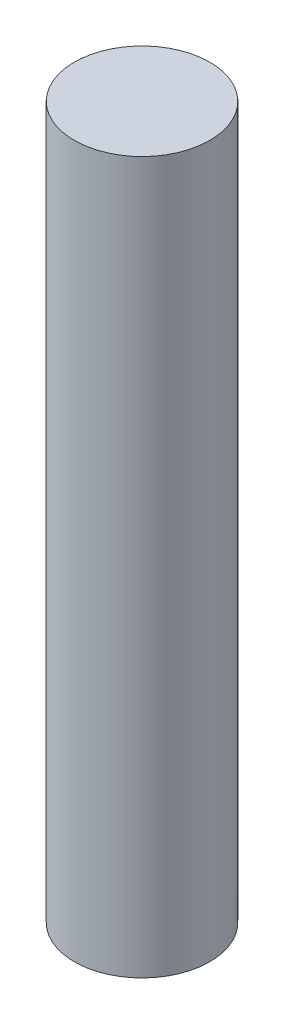
from build123d import *

# Parameters (mm, degrees)
SKETCH1_R           = 2
BOSS_EXTRUDE1_DEPTH = 21


with BuildPart() as part:
    # Sketch1 → Boss-Extrude1 (new body)
    with BuildSketch(Plane(origin=(0, 0, 0), x_dir=(1, 0, 0), z_dir=(0, 1, 0))):
        with Locations(Location((0, 0, 0), (0, 0, 90))):
            Circle(SKETCH1_R)
    extrude(amount=BOSS_EXTRUDE1_DEPTH)


solid = part.part
